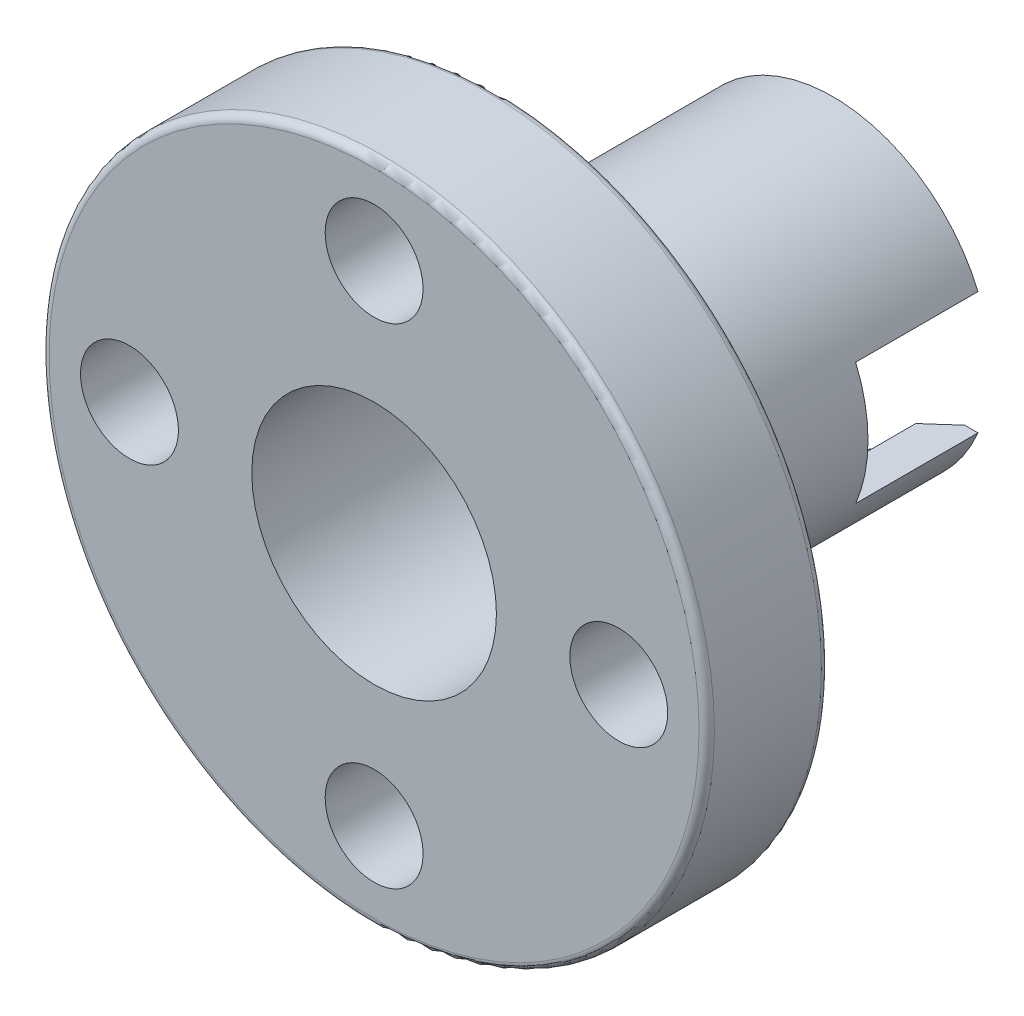
from build123d import *

# Parameters (mm, degrees)
SKETCH2_R          = 4
CUT_EXTRUDE1_DEPTH = 22.483278381
SKETCH3_R          = 1.6
CUT_EXTRUDE2_DEPTH = 19.908496767
SKETCH4_W          = 4
SKETCH4_H          = 4
CUT_EXTRUDE3_DEPTH = 25.496249713
CHAMFER1_SIZE      = 0.75
CHAMFER2_SIZE      = 0.75
FILLET1_R          = 0.5
FILLET2_R          = 0.25


with BuildPart() as part:
    # Sketch1 → Revolve1 (revolve)
    with BuildSketch(Plane(origin=(0, 0, 0), x_dir=(1, 0, 0), z_dir=(0, 1, 0))):
        Polygon((0, 0), (-10.875, 0), (-10.875, 4), (-5.15, 4), (-5.15, 15), (0, 15), align=None)
    revolve(axis=Axis((0, 0, -15), (0, 0, 1)))

    # Sketch2 → Cut-Extrude1 (cut, through all)
    with BuildSketch(Plane(origin=(0, 0, -15), x_dir=(-1, 0, 0), z_dir=(0, 0, -1))):
        Circle(SKETCH2_R)
    extrude(amount=-CUT_EXTRUDE1_DEPTH, mode=Mode.SUBTRACT)

    # Sketch3 → Cut-Extrude2 (cut, through all)
    with BuildSketch(Plane(origin=(0, 0, -4), x_dir=(-1, 0, 0), z_dir=(0, 0, -1))):
        with Locations((0, 8)):
            Circle(SKETCH3_R)
        with Locations((8, 0)):
            Circle(SKETCH3_R)
        with Locations((0, -8)):
            Circle(SKETCH3_R)
        with Locations((-8, 0)):
            Circle(SKETCH3_R)
    extrude(amount=-CUT_EXTRUDE2_DEPTH, mode=Mode.SUBTRACT)

    # Sketch4 → Cut-Extrude3 (cut, through all)
    with BuildSketch(Plane(origin=(5.15, 0, 0), x_dir=(0, 0, -1), z_dir=(1, 0, 0))):
        with Locations((13, 0)):
            Rectangle(SKETCH4_W, SKETCH4_H)
    extrude(amount=-CUT_EXTRUDE3_DEPTH, mode=Mode.SUBTRACT)

    # Chamfer1
    chamfer1_edges = [part.edges().sort_by_distance(p)[0] for p in [
        (0, 4, -15),
    ]]
    chamfer(chamfer1_edges, length=CHAMFER1_SIZE)

    # Chamfer2
    chamfer2_edges = [part.edges().sort_by_distance(p)[0] for p in [
        (0, -4, -15),
    ]]
    chamfer(chamfer2_edges, length=CHAMFER2_SIZE)

    # Fillet1
    fillet1_edges = [part.edges().sort_by_distance(p)[0] for p in [
        (5.15, 0, -4),
    ]]
    fillet(fillet1_edges, radius=FILLET1_R)

    # Fillet2
    fillet2_edges = [part.edges().sort_by_distance(p)[0] for p in [
        (10.875, 0, -4),
        (10.875, 0, 0),
    ]]
    fillet(fillet2_edges, radius=FILLET2_R)


solid = part.part
